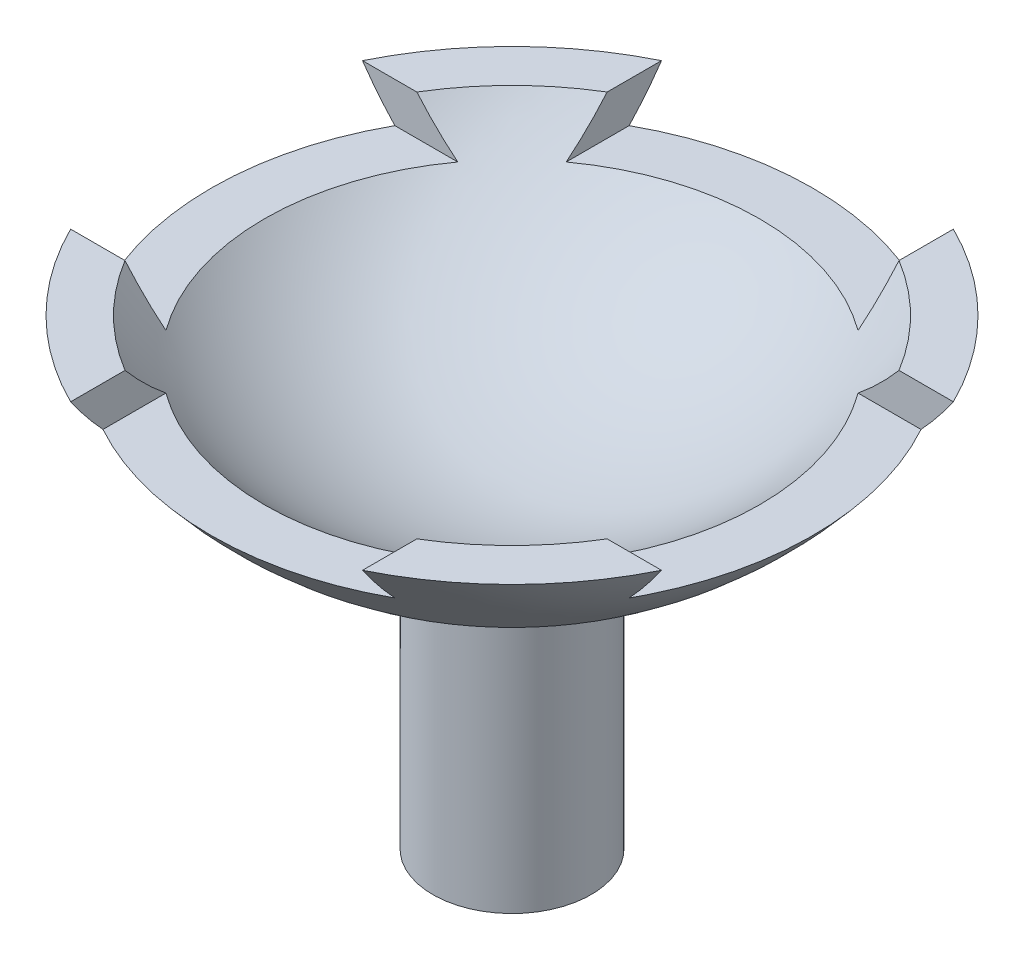
from build123d import *

# Parameters (mm, degrees)
CUT_EXTRUDE1_REACH = 51.712
SKETCH4_W          = 22.11
SKETCH4_H          = 3.04
CIRPATTERN2_COUNT  = 4
FILLET1_R          = 1.5


with BuildPart() as part:
    # Sketch3 → Revolve1 (revolve)
    with BuildSketch(Plane.XY):
        with BuildLine():
            Line((21.348078676, 35), (24.962781559, 35))
            ThreePointArc((24.962781559, 35), (16.839361195, 26.431536124), (6, 21.75))
            Line((6, 21.75), (6, 0))
            Line((6, 0), (0, 0))
            Line((0, 0), (0, 24.131243893))
            ThreePointArc((0, 24.131243893), (11.977795315, 27.004824289), (21.348078676, 35))
        make_face()
    revolve(axis=Axis((0, 24.131243893, 0), (0, -1, 0)))

    # Sketch4 → Cut-Extrude1 (cut, up to next)
    with BuildSketch(Plane.XY, mode=Mode.PRIVATE) as cut_extrude1_sk1:
        with Locations((0, 33.48)):
            Rectangle(SKETCH4_W, SKETCH4_H)
    cut_extrude1_tool1 = extrude(cut_extrude1_sk1.sketch, amount=-CUT_EXTRUDE1_REACH, mode=Mode.PRIVATE) & part.part
    cut_extrude1 = cut_extrude1_tool1.solids().sort_by_distance((0, 33.48, 0))[0]
    add(cut_extrude1, mode=Mode.SUBTRACT)

    # CirPattern2: Cut-Extrude1 ×4 about axis
    cirpattern2_axis = Axis((0, 0, 0), (0, 1, 0))
    for i in range(1, CIRPATTERN2_COUNT):
        add(cut_extrude1.rotate(cirpattern2_axis, i * 360 / CIRPATTERN2_COUNT), mode=Mode.SUBTRACT)

    # Fillet1
    fillet1_edges = [part.edges().sort_by_distance(p)[0] for p in [
        (-6, 21.75, 0),
    ]]
    fillet(fillet1_edges, radius=FILLET1_R)


solid = part.part
